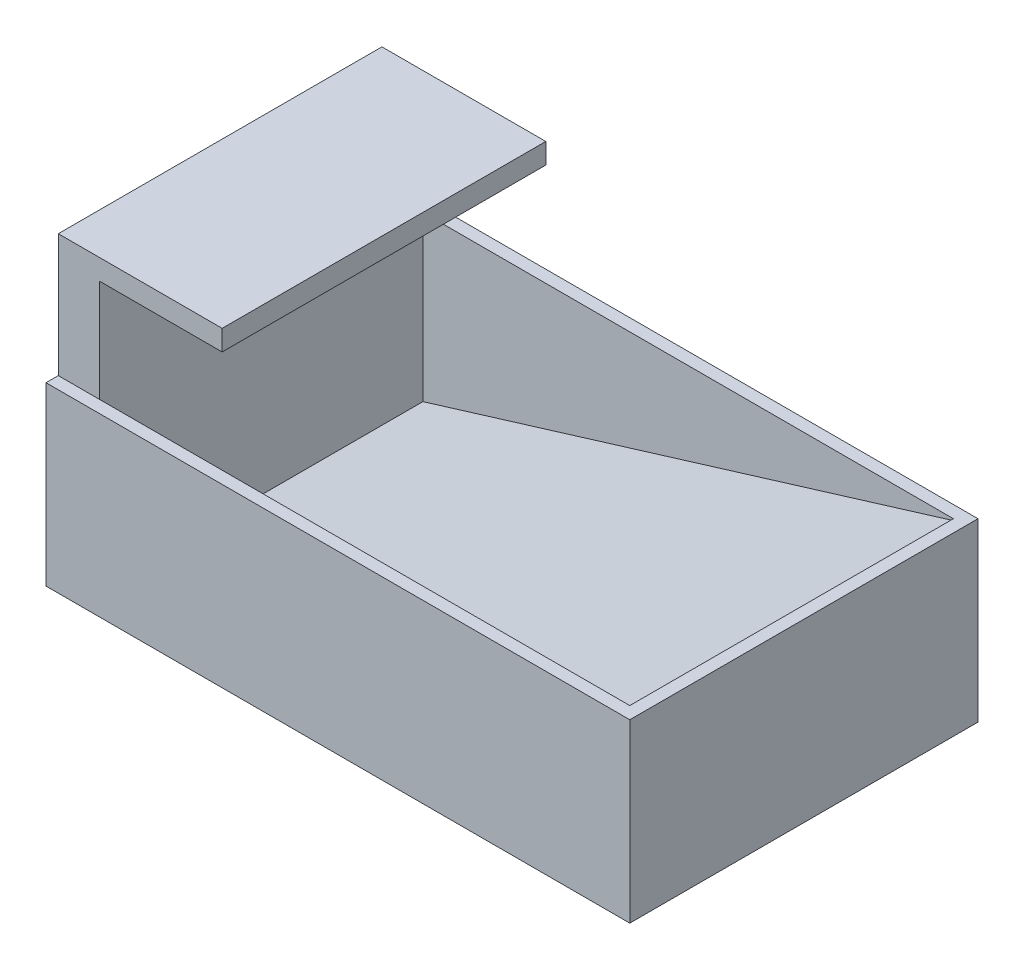
from build123d import *

# Parameters (mm, degrees)
SKETCH1_W           = 142.5
SKETCH1_H           = 85
BOSS_EXTRUDE1_DEPTH = 43
SKETCH2_W           = 129.5
SKETCH2_H           = 79
CUT_EXTRUDE1_DEPTH  = 40
BOSS_EXTRUDE2_DEPTH = 79
BOSS_EXTRUDE3_DEPTH = 79


with BuildPart() as part:
    # Sketch1 → Boss-Extrude1 (new body)
    with BuildSketch(Plane(origin=(0, 0, 0), x_dir=(1, 0, 0), z_dir=(0, 1, 0))):
        with Locations((71.25, 42.5)):
            Rectangle(SKETCH1_W, SKETCH1_H)
    extrude(amount=BOSS_EXTRUDE1_DEPTH)

    # Sketch2 → Cut-Extrude1 (cut)
    with BuildSketch(Plane(origin=(0, 43, 0), x_dir=(1, 0, 0), z_dir=(0, 1, 0))):
        with Locations((74.75, 42.5)):
            Rectangle(SKETCH2_W, SKETCH2_H)
    extrude(amount=-CUT_EXTRUDE1_DEPTH, mode=Mode.SUBTRACT)

    # Sketch5 → Boss-Extrude2 (add)
    with BuildSketch(Plane.XY.offset(-3)):
        Polygon((10, 43), (10, 68), (40, 68), (40, 73), (0, 73), (0, 43), align=None)
    extrude(amount=-BOSS_EXTRUDE2_DEPTH)

    # Sketch6 → Boss-Extrude3 (add)
    with BuildSketch(Plane.XY.offset(-3)):
        Polygon((10, 3), (139.5, 42.592123249), (139.5, 3), align=None)
    extrude(amount=-BOSS_EXTRUDE3_DEPTH)


solid = part.part
